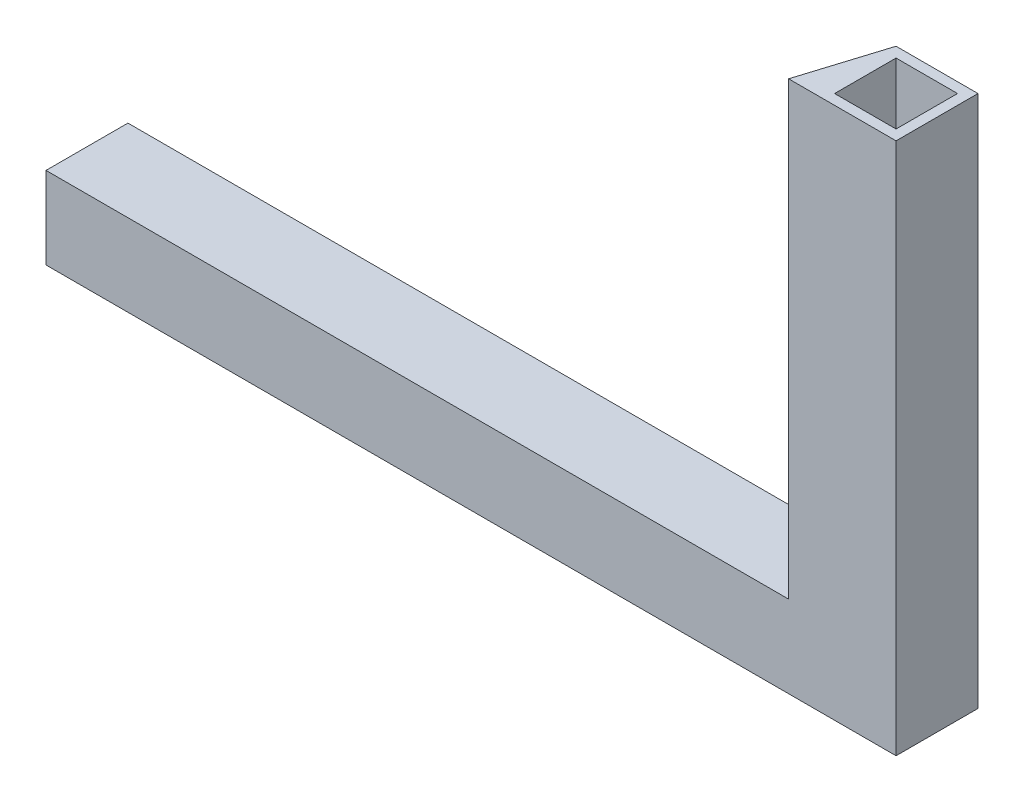
from build123d import *

# Parameters (mm, degrees)
ESQUISSE1_W             = 207.5
ESQUISSE1_H             = 20
BOSS_EXTRU_1_DEPTH      = 20
BOSS_EXTRU_2_DEPTH      = 110
ESQUISSE3_W             = 10
ESQUISSE3_H             = 10
ENL_V_MAT_EXTRU_1_DEPTH = 30
D_GAGEMENT_M31_D        = 3.2
D_GAGEMENT_M31_DEPTH    = 10
D_GAGEMENT_M31_TIP      = 0.96137699
ESQUISSE6_W             = 15
ESQUISSE6_H             = 15
ENL_V_MAT_EXTRU_2_DEPTH = 60


with BuildPart() as part:
    # Esquisse1 → Boss.-Extru.1 (new body)
    with BuildSketch(Plane(origin=(0, 0, 0), x_dir=(1, 0, 0), z_dir=(0, 1, 0))):
        with Locations((103.75, 10)):
            Rectangle(ESQUISSE1_W, ESQUISSE1_H)
    extrude(amount=BOSS_EXTRU_1_DEPTH)

    # Esquisse2 → Boss.-Extru.2 (add)
    with BuildSketch(Plane(origin=(0, 20, 0), x_dir=(1, 0, 0), z_dir=(0, 1, 0))):
        Polygon((207.5, 20), (187.5, 20), (181.270693681, 0), (207.5, 0), align=None)
    extrude(amount=BOSS_EXTRU_2_DEPTH)

    # Esquisse3 → Enlèv. mat.-Extru.1 (cut)
    with BuildSketch(Plane.ZY):
        with Locations((-10, 10)):
            Rectangle(ESQUISSE3_W, ESQUISSE3_H)
    extrude(amount=-ENL_V_MAT_EXTRU_1_DEPTH, mode=Mode.SUBTRACT)

    # Dégagement M31
    with Locations(Plane(origin=(0, 0, -20), x_dir=(-1, 0, 0), z_dir=(0, 0, -1))):
        with Locations((-197.5, 80)):
            Hole(D_GAGEMENT_M31_D / 2, depth=D_GAGEMENT_M31_DEPTH)
            with Locations((0, 0, -(D_GAGEMENT_M31_DEPTH + D_GAGEMENT_M31_TIP / 2))):  # 118° drill point
                Cone(0, D_GAGEMENT_M31_D / 2, D_GAGEMENT_M31_TIP, mode=Mode.SUBTRACT)

    # Esquisse6 → Enlèv. mat.-Extru.2 (cut)
    with BuildSketch(Plane(origin=(0, 130, 0), x_dir=(1, 0, 0), z_dir=(0, 1, 0))):
        with Locations((197.5, 10)):
            Rectangle(ESQUISSE6_W, ESQUISSE6_H)
    extrude(amount=-ENL_V_MAT_EXTRU_2_DEPTH, mode=Mode.SUBTRACT)


solid = part.part
